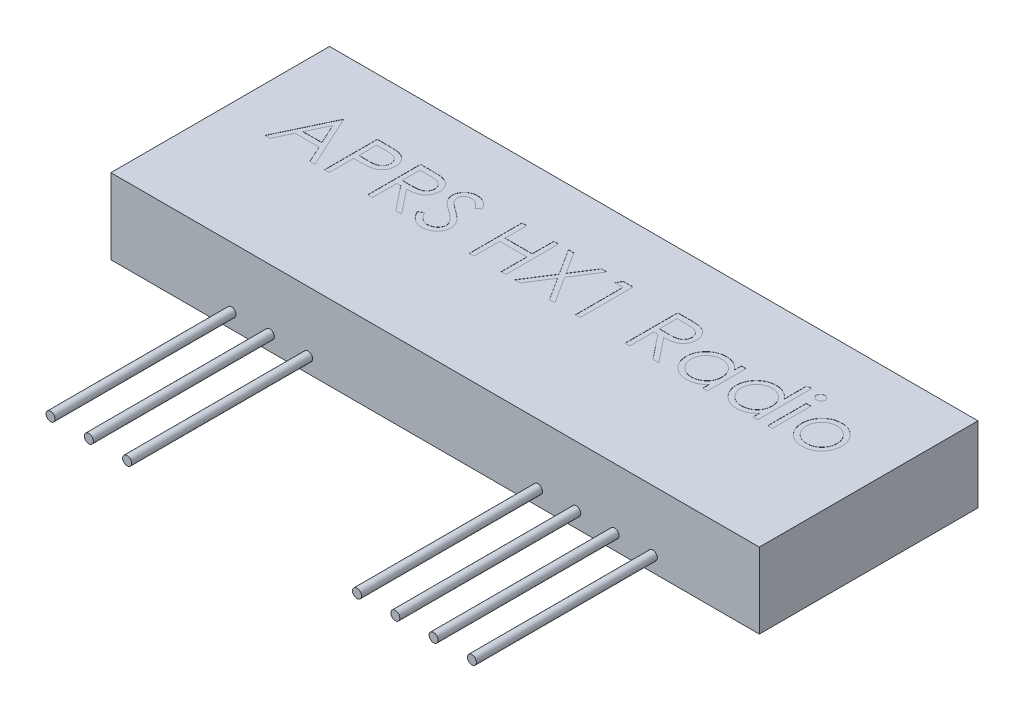
from build123d import *

# Parameters (mm, degrees)
SKETCH2_W           = 43
SKETCH2_H           = 14.5
BOSS_EXTRUDE1_DEPTH = 5
SKETCH3_R           = 0.3
BOSS_EXTRUDE2_DEPTH = 12
SKETCH4_W           = 0.314102564
SKETCH4_H           = 2.557692308
CUT_EXTRUDE1_DEPTH  = 0.01


with BuildPart() as part:
    # Sketch2 → Boss-Extrude1 (new body)
    with BuildSketch(Plane(origin=(0, 0, 0), x_dir=(1, 0, 0), z_dir=(0, 1, 0))):
        Rectangle(SKETCH2_W, SKETCH2_H)
    extrude(amount=BOSS_EXTRUDE1_DEPTH)

    # Sketch3 → Boss-Extrude2 (add)
    with BuildSketch(Plane.XY.offset(7.25)):
        with Locations(Location((6.82, 1, 0), (0, 0, 180))):
            Circle(SKETCH3_R)
        with Locations(Location((9.36, 1, 0), (0, 0, 180))):
            Circle(SKETCH3_R)
        with Locations(Location((11.9, 1, 0), (0, 0, 180))):
            Circle(SKETCH3_R)
        with Locations(Location((14.44, 1, 0), (0, 0, 180))):
            Circle(SKETCH3_R)
        with Locations(Location((-8.42, 1, 0), (0, 0, 180))):
            Circle(SKETCH3_R)
        with Locations(Location((-10.96, 1, 0), (0, 0, 180))):
            Circle(SKETCH3_R)
        with Locations(Location((-13.5, 1, 0), (0, 0, 180))):
            Circle(SKETCH3_R)
    extrude(amount=BOSS_EXTRUDE2_DEPTH)

    # Sketch4 → Cut-Extrude1 (cut)
    # profile 1 of 13: a face of its own
    with BuildSketch(Plane(origin=(0, 5, 0), x_dir=(1, 0, 0), z_dir=(0, 1, 0))):
        Polygon((-16.826923077, 3.5), (-15.211538462, 0), (-15.552984776, 0), (-16.07041266, 1.121794872), (-17.657051282, 1.121794872), (-18.189202724, 0), (-18.532051282, 0), (-16.871794872, 3.5), align=None)
        Polygon((-16.852864583, 2.817808494), (-17.486678686, 1.480769231), (-16.235877404, 1.480769231), align=None, mode=Mode.SUBTRACT)
    # profile 2 of 13: a face of its own
    with BuildSketch(Plane(origin=(0, 5, 0), x_dir=(1, 0, 0), z_dir=(0, 1, 0))):
        with BuildLine():
            Line((-14.583333333, 3.5), (-13.896935096, 3.5))
            add(Edge.make_bspline(
                [(-13.896935096, 3.5), (-13.84972419, 3.499948104), (-13.759265997, 3.499848668), (-13.629550941, 3.496833922), (-13.51174121, 3.49280723), (-13.406090829, 3.487225337), (-13.312274731, 3.480628747), (-13.230717431, 3.471376708), (-13.160777875, 3.461716412), (-13.118871426, 3.451895005), (-13.099759615, 3.447415865)],
                knots=[0, 0, 0, 0, 1.415646017, 2.712440637, 3.8905458, 4.950247383, 5.884950622, 6.709939814, 7.411656543, 8, 8, 8, 8], degree=3))
            add(Edge.make_bspline(
                [(-13.099759615, 3.447415865), (-13.075566082, 3.440793916), (-13.027749104, 3.427706054), (-12.958848061, 3.40149233), (-12.893294216, 3.370410165), (-12.830862657, 3.334986225), (-12.772320574, 3.293700661), (-12.716794533, 3.248227043), (-12.664774553, 3.197515475), (-12.616553161, 3.142134735), (-12.572268364, 3.083014525), (-12.534138681, 3.019272295), (-12.502211454, 2.951980992), (-12.474828182, 2.881187421), (-12.455119728, 2.806297097), (-12.440272828, 2.727830385), (-12.430849201, 2.645795695), (-12.429946639, 2.589735827), (-12.429487179, 2.561197917)],
                knots=[0, 0, 0, 0, 0.999701418, 1.975846123, 2.934577507, 3.890451536, 4.834027766, 5.787354733, 6.749476667, 7.726910423, 8.712836071, 9.690891519, 10.682875813, 11.679750201, 12.712814741, 13.765529915, 14.8625177, 16, 16, 16, 16], degree=3))
            add(Edge.make_bspline(
                [(-12.429487179, 2.561197917), (-12.429908604, 2.53242014), (-12.43073315, 2.476114476), (-12.440629435, 2.393741688), (-12.453959627, 2.315023298), (-12.474456679, 2.240133847), (-12.501302353, 2.169518077), (-12.532794405, 2.102096845), (-12.570777936, 2.039017173), (-12.614422765, 1.980050055), (-12.66297436, 1.925140143), (-12.716227298, 1.874685348), (-12.773966591, 1.82898101), (-12.836008739, 1.787924666), (-12.902958587, 1.752468387), (-12.973800741, 1.720711082), (-13.049150957, 1.694040021), (-13.101293471, 1.68000996), (-13.127804487, 1.672876603)],
                knots=[0, 0, 0, 0, 1.121902311, 2.195077645, 3.232258892, 4.234102512, 5.217864754, 6.176164875, 7.132989551, 8.084763148, 9.034132444, 9.988522005, 10.94243251, 11.903244335, 12.886203696, 13.894208494, 14.929344452, 16, 16, 16, 16], degree=3))
            add(Edge.make_bspline(
                [(-13.127804487, 1.672876603), (-13.149731821, 1.668213621), (-13.197786849, 1.657994427), (-13.276929571, 1.64658597), (-13.369074957, 1.63684837), (-13.474097237, 1.629547232), (-13.591902141, 1.623296864), (-13.722553399, 1.61832877), (-13.866307476, 1.615598916), (-13.96657872, 1.615458123), (-14.018930288, 1.615384615)],
                knots=[0, 0, 0, 0, 0.601384939, 1.31797006, 2.144135048, 3.087295005, 4.142315834, 5.309527816, 6.595305764, 8, 8, 8, 8], degree=3))
            Line((-14.018930288, 1.615384615), (-14.269230769, 1.615384615))
            Line((-14.269230769, 1.615384615), (-14.269230769, 0))
            Line((-14.269230769, 0), (-14.583333333, 0))
            Line((-14.583333333, 0), (-14.583333333, 3.5))
        make_face()
        with BuildLine():
            Line((-14.269230769, 3.141025641), (-14.269230769, 1.974358974))
            Line((-14.269230769, 1.974358974), (-13.656450321, 1.966646635))
            add(Edge.make_bspline(
                [(-13.656450321, 1.966646635), (-13.626530395, 1.966631171), (-13.568770595, 1.966601319), (-13.485334372, 1.970586542), (-13.407925084, 1.975187075), (-13.336780509, 1.981922998), (-13.271868574, 1.991444256), (-13.213081045, 2.001055994), (-13.160873763, 2.014961356), (-13.099774561, 2.033684426), (-13.031691213, 2.065617041), (-12.957623665, 2.111966931), (-12.894853078, 2.17104764), (-12.840534782, 2.237475471), (-12.797428904, 2.3113746), (-12.765872911, 2.390443537), (-12.747331754, 2.473871387), (-12.74484556, 2.530959525), (-12.743589744, 2.559795673)],
                knots=[0, 0, 0, 0, 1.160613943, 2.240541288, 3.23993089, 4.169200891, 5.011653406, 5.7853311, 6.478053781, 7.106038997, 8.262395093, 9.384106736, 10.481365981, 11.59014053, 12.70357646, 13.786202915, 14.881775077, 16, 16, 16, 16], degree=3))
            add(Edge.make_bspline(
                [(-12.743589744, 2.559795673), (-12.74485239, 2.587934187), (-12.747362375, 2.643870069), (-12.766018238, 2.725848829), (-12.797367552, 2.804084534), (-12.840824147, 2.877057619), (-12.893565277, 2.943246423), (-12.95486462, 3.00074355), (-13.024577881, 3.046965253), (-13.089426112, 3.076798534), (-13.147027298, 3.09501381), (-13.197059258, 3.10775865), (-13.253549932, 3.117934257), (-13.316517712, 3.126173759), (-13.385474546, 3.133227221), (-13.461012861, 3.138013198), (-13.542846504, 3.140814654), (-13.599657075, 3.140953609), (-13.629106571, 3.141025641)],
                knots=[0, 0, 0, 0, 1.120700087, 2.227813068, 3.331159281, 4.466773991, 5.599788987, 6.693661531, 7.80175334, 8.91857717, 9.525282508, 10.207424825, 10.974604443, 11.810962634, 12.737642355, 13.736264703, 14.826523623, 16, 16, 16, 16], degree=3))
            Line((-13.629106571, 3.141025641), (-14.269230769, 3.141025641))
        make_face(mode=Mode.SUBTRACT)
    # profile 3 of 13: a face of its own
    with BuildSketch(Plane(origin=(0, 5, 0), x_dir=(1, 0, 0), z_dir=(0, 1, 0))):
        with BuildLine():
            Line((-11.711538462, 3.5), (-11.011117788, 3.5))
            add(Edge.make_bspline(
                [(-11.011117788, 3.5), (-10.96437666, 3.499844414), (-10.874628516, 3.499545672), (-10.746055245, 3.497879909), (-10.629228148, 3.493105553), (-10.524208309, 3.48899697), (-10.430997654, 3.481505028), (-10.349310363, 3.474344381), (-10.279522666, 3.46497072), (-10.237276814, 3.456265297), (-10.218149038, 3.452323718)],
                knots=[0, 0, 0, 0, 1.410062039, 2.707475311, 3.878576406, 4.937260626, 5.877586885, 6.699081471, 7.410979367, 8, 8, 8, 8], degree=3))
            add(Edge.make_bspline(
                [(-10.218149038, 3.452323718), (-10.192542414, 3.445996953), (-10.141875425, 3.433478389), (-10.068925359, 3.407018788), (-9.999411035, 3.376399163), (-9.933621211, 3.340435443), (-9.871885419, 3.298860663), (-9.813567109, 3.252392541), (-9.758401645, 3.201285335), (-9.708620015, 3.144250494), (-9.661680963, 3.084413984), (-9.622092337, 3.019710227), (-9.587965857, 2.9520487), (-9.56079534, 2.880741282), (-9.538917367, 2.80647951), (-9.523491127, 2.728590713), (-9.51423994, 2.647429738), (-9.513298084, 2.59207183), (-9.512820513, 2.564002404)],
                knots=[0, 0, 0, 0, 1.027469482, 2.033020251, 3.019912614, 3.986113645, 4.951240523, 5.91722682, 6.890402269, 7.87763091, 8.8651537, 9.85103654, 10.82876324, 11.815024772, 12.821070561, 13.842952187, 14.906261191, 16, 16, 16, 16], degree=3))
            add(Edge.make_bspline(
                [(-9.512820513, 2.564002404), (-9.514289511, 2.517367299), (-9.517155907, 2.426370131), (-9.54388101, 2.29430925), (-9.58765753, 2.171119935), (-9.647980819, 2.056957297), (-9.724800295, 1.954046652), (-9.817125086, 1.863656197), (-9.925006697, 1.788016284), (-10.025436013, 1.735563479), (-10.114150213, 1.701970571), (-10.187183526, 1.678334212), (-10.266850503, 1.660072247), (-10.352387838, 1.643712115), (-10.444151493, 1.63136042), (-10.541921533, 1.622313826), (-10.645767684, 1.616659777), (-10.717106754, 1.615817772), (-10.75380609, 1.615384615)],
                knots=[0, 0, 0, 0, 1.260483769, 2.459530307, 3.627416485, 4.787058657, 5.939039949, 7.08810263, 8.267026773, 9.491475466, 10.141966685, 10.831826277, 11.566392101, 12.351337768, 13.187381173, 14.07005841, 15.007169909, 16, 16, 16, 16], degree=3))
            Line((-10.75380609, 1.615384615), (-9.467948718, 0))
            Line((-9.467948718, 0), (-9.856370192, 0))
            Line((-9.856370192, 0), (-11.142227564, 1.615384615))
            Line((-11.142227564, 1.615384615), (-11.397435897, 1.615384615))
            Line((-11.397435897, 1.615384615), (-11.397435897, 0))
            Line((-11.397435897, 0), (-11.711538462, 0))
            Line((-11.711538462, 0), (-11.711538462, 3.5))
        make_face()
        with BuildLine():
            Line((-11.397435897, 3.141025641), (-11.397435897, 1.974358974))
            Line((-11.397435897, 1.974358974), (-10.756610577, 1.969451122))
            add(Edge.make_bspline(
                [(-10.756610577, 1.969451122), (-10.726690538, 1.969437885), (-10.668696981, 1.969412229), (-10.584796316, 1.973406005), (-10.506676204, 1.977949323), (-10.434635452, 1.984898669), (-10.368641877, 1.99385474), (-10.308728464, 2.005057725), (-10.254797412, 2.018109787), (-10.191898873, 2.038311413), (-10.121662342, 2.070317431), (-10.045330882, 2.11688293), (-9.980328544, 2.175452049), (-9.925410682, 2.242425505), (-9.881281251, 2.316061754), (-9.850169196, 2.395478123), (-9.830426754, 2.478669721), (-9.828098209, 2.535847829), (-9.826923077, 2.564703526)],
                knots=[0, 0, 0, 0, 1.146690395, 2.22261258, 3.21895312, 4.145990853, 4.996080663, 5.770904154, 6.481378293, 7.121626537, 8.300444488, 9.431385265, 10.535395872, 11.636531494, 12.74115979, 13.810798291, 14.895190096, 16, 16, 16, 16], degree=3))
            add(Edge.make_bspline(
                [(-9.826923077, 2.564703526), (-9.828125198, 2.592850099), (-9.830507363, 2.648626338), (-9.849956132, 2.730282248), (-9.882845513, 2.807349198), (-9.927167751, 2.879513683), (-9.981166906, 2.945019419), (-10.044484719, 3.001066572), (-10.115389914, 3.047316037), (-10.181661112, 3.076870418), (-10.240895325, 3.094990271), (-10.292324985, 3.107741435), (-10.350436463, 3.117985904), (-10.415511921, 3.126193964), (-10.487273552, 3.133248909), (-10.566084203, 3.138000687), (-10.651420983, 3.140814551), (-10.710567915, 3.14095364), (-10.741185897, 3.141025641)],
                knots=[0, 0, 0, 0, 1.101028733, 2.181837193, 3.264309656, 4.369019818, 5.486613113, 6.575447106, 7.666700264, 8.788928104, 9.402425223, 10.0903467, 10.862060571, 11.710948788, 12.657782767, 13.684531032, 14.801375019, 16, 16, 16, 16], degree=3))
            Line((-10.741185897, 3.141025641), (-11.397435897, 3.141025641))
        make_face(mode=Mode.SUBTRACT)
    # profile 4 of 13: a face of its own
    with BuildSketch(Plane(origin=(0, 5, 0), x_dir=(1, 0, 0), z_dir=(0, 1, 0))):
        with BuildLine():
            Line((-9.108974359, 0.675180288), (-8.813100962, 0.852564103))
            add(Edge.make_bspline(
                [(-8.813100962, 0.852564103), (-8.785582724, 0.806499718), (-8.732858844, 0.718242134), (-8.644907485, 0.598984093), (-8.553774573, 0.497621937), (-8.45878524, 0.414745329), (-8.360519292, 0.349496442), (-8.258335238, 0.303294211), (-8.152577427, 0.274478235), (-8.080603606, 0.270978149), (-8.044671474, 0.269230769)],
                knots=[0, 0, 0, 0, 1.272034388, 2.437168799, 3.508375237, 4.49857839, 5.41946034, 6.295179144, 7.148887113, 8, 8, 8, 8], degree=3))
            add(Edge.make_bspline(
                [(-8.044671474, 0.269230769), (-8.013984614, 0.270085442), (-7.953147841, 0.271779832), (-7.863585598, 0.288060634), (-7.776603796, 0.313072763), (-7.693995158, 0.348893694), (-7.616899543, 0.39223218), (-7.549292848, 0.444578358), (-7.490846735, 0.503184563), (-7.44303762, 0.568567218), (-7.406357585, 0.638884367), (-7.378165517, 0.711060318), (-7.362520443, 0.786228886), (-7.360163689, 0.836839349), (-7.358974359, 0.862379808)],
                knots=[0, 0, 0, 0, 1.095163259, 2.171163733, 3.241058638, 4.321873601, 5.38011039, 6.391990106, 7.366004449, 8.327778327, 9.272591725, 10.192022065, 11.087607919, 12, 12, 12, 12], degree=3))
            add(Edge.make_bspline(
                [(-7.358974359, 0.862379808), (-7.36044867, 0.891520657), (-7.363445728, 0.950759747), (-7.388777208, 1.0381594), (-7.428626455, 1.12465197), (-7.465389099, 1.178153235), (-7.48447516, 1.205929487)],
                knots=[0, 0, 0, 0, 0.938893495, 1.908633276, 2.914225137, 4, 4, 4, 4], degree=3))
            add(Edge.make_bspline(
                [(-7.48447516, 1.205929487), (-7.500145774, 1.225976311), (-7.533044269, 1.268062109), (-7.589601781, 1.330707345), (-7.655967896, 1.395325764), (-7.729871451, 1.464384821), (-7.814004539, 1.534672617), (-7.905732054, 1.609540895), (-8.007395913, 1.686142472), (-8.078695409, 1.737515038), (-8.115484776, 1.764022436)],
                knots=[0, 0, 0, 0, 0.722233717, 1.516239348, 2.393582979, 3.351407094, 4.387010283, 5.505090956, 6.712668013, 8, 8, 8, 8], degree=3))
            add(Edge.make_bspline(
                [(-8.115484776, 1.764022436), (-8.152308772, 1.790251024), (-8.222713448, 1.840398086), (-8.321172031, 1.91482237), (-8.409216494, 1.982866239), (-8.48645551, 2.045170251), (-8.552855107, 2.101742856), (-8.608938518, 2.152040795), (-8.653277075, 2.197424356), (-8.677932656, 2.226865698), (-8.689002404, 2.240084135)],
                knots=[0, 0, 0, 0, 1.452282411, 2.77665338, 3.964542531, 5.026858415, 5.96415736, 6.766646006, 7.446254459, 8, 8, 8, 8], degree=3))
            add(Edge.make_bspline(
                [(-8.689002404, 2.240084135), (-8.704474949, 2.260685171), (-8.734903786, 2.301199875), (-8.775069791, 2.364524733), (-8.809208954, 2.429347998), (-8.835971286, 2.495843863), (-8.858507505, 2.563078792), (-8.873665436, 2.631930038), (-8.883156833, 2.702088656), (-8.884128819, 2.749302157), (-8.884615385, 2.772936699)],
                knots=[0, 0, 0, 0, 1.068054152, 2.10047183, 3.106115577, 4.101338837, 5.06977816, 6.043150881, 7.020423561, 8, 8, 8, 8], degree=3))
            add(Edge.make_bspline(
                [(-8.884615385, 2.772936699), (-8.883310176, 2.809966473), (-8.880727656, 2.883234537), (-8.858887138, 2.990265367), (-8.824414245, 3.092451785), (-8.776119357, 3.188782118), (-8.713862004, 3.276748099), (-8.641816029, 3.357361586), (-8.556004543, 3.425130168), (-8.46185192, 3.484342227), (-8.358795548, 3.530688152), (-8.250804645, 3.565649132), (-8.137707572, 3.58545839), (-8.061104438, 3.588301155), (-8.022235577, 3.58974359)],
                knots=[0, 0, 0, 0, 1.005424448, 1.989358655, 2.955360095, 3.929531133, 4.905563448, 5.876582895, 6.856512386, 7.866279853, 8.892233794, 9.918561126, 10.94386622, 12, 12, 12, 12], degree=3))
            add(Edge.make_bspline(
                [(-8.022235577, 3.58974359), (-7.980991477, 3.588321038), (-7.898970125, 3.585492037), (-7.778320909, 3.560894506), (-7.662160193, 3.520193834), (-7.568716928, 3.474005176), (-7.495584167, 3.42787376), (-7.439811434, 3.385853936), (-7.383293983, 3.337478827), (-7.325575928, 3.282619581), (-7.267635269, 3.22077283), (-7.208611817, 3.152362141), (-7.148367548, 3.077805585), (-7.109611688, 3.024581085), (-7.08974359, 2.997295673)],
                knots=[0, 0, 0, 0, 1.286793592, 2.559021753, 3.825965368, 5.121522368, 5.803751409, 6.523245864, 7.299691795, 8.125521123, 9.008227632, 9.944561021, 10.946284179, 12, 12, 12, 12], degree=3))
            Line((-7.08974359, 2.997295673), (-7.373697917, 2.782051282))
            add(Edge.make_bspline(
                [(-7.373697917, 2.782051282), (-7.390843849, 2.804139972), (-7.423862906, 2.846677626), (-7.473992393, 2.906248941), (-7.521241041, 2.960665421), (-7.567791441, 3.007930549), (-7.611185072, 3.050632682), (-7.653302114, 3.087192439), (-7.693536466, 3.117968034), (-7.744253376, 3.150811594), (-7.807971095, 3.183368098), (-7.887955631, 3.210917176), (-7.971541906, 3.227472238), (-8.028471537, 3.229661126), (-8.057291667, 3.230769231)],
                knots=[0, 0, 0, 0, 1.181633172, 2.275549214, 3.290209073, 4.226197932, 5.078386478, 5.862611352, 6.581680152, 7.217281963, 8.414376989, 9.595101626, 10.782541182, 12, 12, 12, 12], degree=3))
            add(Edge.make_bspline(
                [(-8.057291667, 3.230769231), (-8.093448189, 3.229557531), (-8.163172636, 3.227220882), (-8.262162873, 3.201700896), (-8.351256798, 3.161519036), (-8.427809363, 3.105204058), (-8.49154634, 3.038483065), (-8.537651799, 2.96170421), (-8.565401963, 2.876921808), (-8.568788243, 2.817780151), (-8.570512821, 2.787660256)],
                knots=[0, 0, 0, 0, 1.14458467, 2.207223713, 3.21896685, 4.227309161, 5.202851033, 6.127160689, 7.046193047, 8, 8, 8, 8], degree=3))
            add(Edge.make_bspline(
                [(-8.570512821, 2.787660256), (-8.570119694, 2.768908778), (-8.569332798, 2.731375158), (-8.558358, 2.675923736), (-8.544258671, 2.620612397), (-8.521916039, 2.565689814), (-8.491070736, 2.510195455), (-8.45056556, 2.453173718), (-8.399552248, 2.394122009), (-8.360475235, 2.355714635), (-8.33984375, 2.335436699)],
                knots=[0, 0, 0, 0, 0.858281714, 1.717966888, 2.583508476, 3.4729293, 4.427298488, 5.488583878, 6.674047936, 8, 8, 8, 8], degree=3))
            add(Edge.make_bspline(
                [(-8.33984375, 2.335436699), (-8.332182378, 2.328599673), (-8.31398071, 2.312356465), (-8.280704785, 2.285764184), (-8.236761986, 2.252961412), (-8.183299785, 2.212374095), (-8.119332424, 2.165292633), (-8.044852867, 2.112319021), (-7.960691335, 2.051733562), (-7.900969419, 2.009376021), (-7.869391026, 1.986979167)],
                knots=[0, 0, 0, 0, 0.420754252, 0.999615792, 1.744751191, 2.668019286, 3.750313428, 4.999500688, 6.413464383, 8, 8, 8, 8], degree=3))
            add(Edge.make_bspline(
                [(-7.869391026, 1.986979167), (-7.831405112, 1.959337807), (-7.757850656, 1.905814145), (-7.653193076, 1.825398465), (-7.558299268, 1.746750697), (-7.472836064, 1.67037309), (-7.395959156, 1.596844997), (-7.328521435, 1.525281816), (-7.269835755, 1.456196244), (-7.206656536, 1.367623668), (-7.142098717, 1.258842584), (-7.08665721, 1.125564345), (-7.051698862, 0.991768025), (-7.047127347, 0.901841188), (-7.044871795, 0.857471955)],
                knots=[0, 0, 0, 0, 1.163667725, 2.253281268, 3.268753668, 4.215851969, 5.092017293, 5.902905408, 6.650798638, 7.335211899, 8.59617414, 9.77448103, 10.901945474, 12, 12, 12, 12], degree=3))
            add(Edge.make_bspline(
                [(-7.044871795, 0.857471955), (-7.045528933, 0.82609359), (-7.046830448, 0.763946206), (-7.061791362, 0.67269113), (-7.083711027, 0.58406026), (-7.116748261, 0.499149147), (-7.157071419, 0.416404385), (-7.208237667, 0.337996484), (-7.267545352, 0.262190086), (-7.335579117, 0.191006594), (-7.410025019, 0.125660398), (-7.488708714, 0.067531337), (-7.571758987, 0.019063014), (-7.658725303, -0.020487828), (-7.74962764, -0.051421346), (-7.844435424, -0.073834215), (-7.943304935, -0.087589926), (-8.010505417, -0.089017687), (-8.044671474, -0.08974359)],
                knots=[0, 0, 0, 0, 0.983748083, 1.948392443, 2.894712957, 3.844097841, 4.80183111, 5.778335162, 6.776009319, 7.81870978, 8.863265674, 9.881300176, 10.883814829, 11.87499822, 12.874611388, 13.892143829, 14.928324115, 16, 16, 16, 16], degree=3))
            add(Edge.make_bspline(
                [(-8.044671474, -0.08974359), (-8.071106817, -0.089232408), (-8.123644577, -0.088216483), (-8.201354059, -0.079235202), (-8.277493648, -0.066528099), (-8.35110793, -0.046354029), (-8.423145342, -0.021877052), (-8.493292577, 0.008261281), (-8.561583631, 0.044378482), (-8.628401213, 0.085673507), (-8.693575388, 0.133731252), (-8.756494856, 0.189704748), (-8.819224041, 0.252050253), (-8.879911438, 0.322460816), (-8.939784582, 0.399798899), (-8.997662992, 0.484788083), (-9.054744709, 0.576965436), (-9.090560177, 0.641830522), (-9.108974359, 0.675180288)],
                knots=[0, 0, 0, 0, 0.915332311, 1.819136955, 2.706846663, 3.586547465, 4.459518054, 5.340707479, 6.227863349, 7.133153174, 8.059268498, 9.028702269, 10.047606654, 11.120612155, 12.245963614, 13.433783089, 14.680604001, 16, 16, 16, 16], degree=3))
        make_face()
    # profile 5 of 13: a face of its own
    with BuildSketch(Plane(origin=(0, 5, 0), x_dir=(1, 0, 0), z_dir=(0, 1, 0))):
        Polygon((-4.980769231, 3.5), (-4.666666667, 3.5), (-4.666666667, 2.064102564), (-2.871794872, 2.064102564), (-2.871794872, 3.5), (-2.557692308, 3.5), (-2.557692308, 0), (-2.871794872, 0), (-2.871794872, 1.705128205), (-4.666666667, 1.705128205), (-4.666666667, 0), (-4.980769231, 0), align=None)
    # profile 6 of 13: a face of its own
    with BuildSketch(Plane(origin=(0, 5, 0), x_dir=(1, 0, 0), z_dir=(0, 1, 0))):
        Polygon((-1.907051282, 3.5), (-1.544571314, 3.5), (-0.628205128, 2.068309295), (0.288161058, 3.5), (0.650641026, 3.5), (-0.446614583, 1.78505609), (0.695512821, 0), (0.333032853, 0), (-0.628205128, 1.501802885), (-1.589443109, 0), (-1.951923077, 0), (-0.809094551, 1.78505609), align=None)
    # profile 7 of 13: a face of its own
    with BuildSketch(Plane(origin=(0, 5, 0), x_dir=(1, 0, 0), z_dir=(0, 1, 0))):
        Polygon((1.731069712, 3.5), (2.378205128, 3.5), (2.378205128, 0), (2.064102564, 0), (2.064102564, 3.141025641), (1.525641026, 3.141025641), align=None)
    # profile 8 of 13: a face of its own
    with BuildSketch(Plane(origin=(0, 5, 0), x_dir=(1, 0, 0), z_dir=(0, 1, 0))):
        with BuildLine():
            Line((5.33974359, 3.5), (6.040164263, 3.5))
            add(Edge.make_bspline(
                [(6.040164263, 3.5), (6.086905391, 3.499844414), (6.176653536, 3.499545672), (6.305226806, 3.497879909), (6.422053903, 3.493105553), (6.527073742, 3.48899697), (6.620284397, 3.481505028), (6.701971688, 3.474344381), (6.771759386, 3.46497072), (6.814005237, 3.456265297), (6.833133013, 3.452323718)],
                knots=[0, 0, 0, 0, 1.410062039, 2.707475311, 3.878576406, 4.937260626, 5.877586885, 6.699081471, 7.410979367, 8, 8, 8, 8], degree=3))
            add(Edge.make_bspline(
                [(6.833133013, 3.452323718), (6.858739637, 3.445996953), (6.909406626, 3.433478389), (6.982356692, 3.407018788), (7.051871016, 3.376399163), (7.117660841, 3.340435443), (7.179396632, 3.298860663), (7.237714943, 3.252392541), (7.292880406, 3.201285335), (7.342662036, 3.144250494), (7.389601088, 3.084413984), (7.429189714, 3.019710227), (7.463316194, 2.9520487), (7.490486711, 2.880741282), (7.512364685, 2.80647951), (7.527790924, 2.728590713), (7.537042112, 2.647429738), (7.537983967, 2.59207183), (7.538461538, 2.564002404)],
                knots=[0, 0, 0, 0, 1.027469482, 2.033020251, 3.019912614, 3.986113645, 4.951240523, 5.91722682, 6.890402269, 7.87763091, 8.8651537, 9.85103654, 10.82876324, 11.815024772, 12.821070561, 13.842952187, 14.906261191, 16, 16, 16, 16], degree=3))
            add(Edge.make_bspline(
                [(7.538461538, 2.564002404), (7.53699254, 2.517367299), (7.534126145, 2.426370131), (7.507401041, 2.29430925), (7.463624521, 2.171119935), (7.403301232, 2.056957297), (7.326481756, 1.954046652), (7.234156965, 1.863656197), (7.126275354, 1.788016284), (7.025846038, 1.735563479), (6.937131838, 1.701970571), (6.864098525, 1.678334212), (6.784431548, 1.660072247), (6.698894213, 1.643712115), (6.607130558, 1.63136042), (6.509360518, 1.622313826), (6.405514367, 1.616659777), (6.334175297, 1.615817772), (6.297475962, 1.615384615)],
                knots=[0, 0, 0, 0, 1.260483769, 2.459530307, 3.627416485, 4.787058657, 5.939039949, 7.08810263, 8.267026773, 9.491475466, 10.141966685, 10.831826277, 11.566392101, 12.351337768, 13.187381173, 14.07005841, 15.007169909, 16, 16, 16, 16], degree=3))
            Line((6.297475962, 1.615384615), (7.583333333, 0))
            Line((7.583333333, 0), (7.194911859, 0))
            Line((7.194911859, 0), (5.909054487, 1.615384615))
            Line((5.909054487, 1.615384615), (5.653846154, 1.615384615))
            Line((5.653846154, 1.615384615), (5.653846154, 0))
            Line((5.653846154, 0), (5.33974359, 0))
            Line((5.33974359, 0), (5.33974359, 3.5))
        make_face()
        with BuildLine():
            Line((5.653846154, 3.141025641), (5.653846154, 1.974358974))
            Line((5.653846154, 1.974358974), (6.294671474, 1.969451122))
            add(Edge.make_bspline(
                [(6.294671474, 1.969451122), (6.324591513, 1.969437885), (6.38258507, 1.969412229), (6.466485735, 1.973406005), (6.544605847, 1.977949323), (6.616646599, 1.984898669), (6.682640174, 1.99385474), (6.742553588, 2.005057725), (6.79648464, 2.018109787), (6.859383178, 2.038311413), (6.929619709, 2.070317431), (7.005951169, 2.11688293), (7.070953507, 2.175452049), (7.125871369, 2.242425505), (7.170000801, 2.316061754), (7.201112855, 2.395478123), (7.220855297, 2.478669721), (7.223183843, 2.535847829), (7.224358974, 2.564703526)],
                knots=[0, 0, 0, 0, 1.146690395, 2.22261258, 3.21895312, 4.145990853, 4.996080663, 5.770904154, 6.481378293, 7.121626537, 8.300444488, 9.431385265, 10.535395872, 11.636531494, 12.74115979, 13.810798291, 14.895190096, 16, 16, 16, 16], degree=3))
            add(Edge.make_bspline(
                [(7.224358974, 2.564703526), (7.223156853, 2.592850099), (7.220774688, 2.648626338), (7.201325919, 2.730282248), (7.168436538, 2.807349198), (7.1241143, 2.879513683), (7.070115145, 2.945019419), (7.006797332, 3.001066572), (6.935892137, 3.047316037), (6.869620939, 3.076870418), (6.810386726, 3.094990271), (6.758957066, 3.107741435), (6.700845589, 3.117985904), (6.63577013, 3.126193964), (6.564008499, 3.133248909), (6.485197848, 3.138000687), (6.399861068, 3.140814551), (6.340714137, 3.14095364), (6.310096154, 3.141025641)],
                knots=[0, 0, 0, 0, 1.101028733, 2.181837193, 3.264309656, 4.369019818, 5.486613113, 6.575447106, 7.666700264, 8.788928104, 9.402425223, 10.0903467, 10.862060571, 11.710948788, 12.657782767, 13.684531032, 14.801375019, 16, 16, 16, 16], degree=3))
            Line((6.310096154, 3.141025641), (5.653846154, 3.141025641))
        make_face(mode=Mode.SUBTRACT)
    # profile 9 of 13: a face of its own
    with BuildSketch(Plane(origin=(0, 5, 0), x_dir=(1, 0, 0), z_dir=(0, 1, 0))):
        with BuildLine():
            Line((10.814102564, 2.557692308), (10.814102564, 0))
            Line((10.814102564, 0), (10.5, 0))
            Line((10.5, 0), (10.5, 0.442407853))
            add(Edge.make_bspline(
                [(10.5, 0.442407853), (10.464581209, 0.402368259), (10.395460994, 0.324230488), (10.280019876, 0.222148315), (10.157651698, 0.137769993), (10.028950377, 0.069620078), (9.894032134, 0.018428021), (9.753196046, -0.017958138), (9.606384666, -0.041351973), (9.506132311, -0.043687995), (9.455328526, -0.044871795)],
                knots=[0, 0, 0, 0, 1.074387032, 2.096679803, 3.090159297, 4.057316773, 5.018401886, 5.985159533, 6.978961417, 8, 8, 8, 8], degree=3))
            add(Edge.make_bspline(
                [(9.455328526, -0.044871795), (9.410160572, -0.043645423), (9.321087367, -0.041226962), (9.19005829, -0.022464659), (9.06396604, 0.007665963), (8.942691468, 0.049566853), (8.827019322, 0.105147674), (8.715959226, 0.171688922), (8.610086534, 0.250929752), (8.511014995, 0.341517781), (8.419782994, 0.439912768), (8.339721722, 0.544858315), (8.272968642, 0.655900619), (8.217148561, 0.771633773), (8.174152217, 0.892948692), (8.144178582, 1.01942586), (8.125438136, 1.150915734), (8.123020675, 1.240455257), (8.121794872, 1.285857372)],
                knots=[0, 0, 0, 0, 1.033919861, 2.038935746, 3.024066025, 3.998881131, 4.97069526, 5.957263378, 6.95902576, 7.993208707, 9.027059324, 10.027763471, 11.009749337, 11.988697705, 12.965288445, 13.950418724, 14.960734635, 16, 16, 16, 16], degree=3))
            add(Edge.make_bspline(
                [(8.121794872, 1.285857372), (8.123047843, 1.330321075), (8.1255249, 1.418223419), (8.14397812, 1.547502117), (8.175009129, 1.672020377), (8.218556976, 1.791377321), (8.274398931, 1.905717371), (8.342327018, 2.015121396), (8.422346143, 2.119890793), (8.51459855, 2.21756202), (8.61453332, 2.307782634), (8.721442051, 2.38619168), (8.832665332, 2.453908529), (8.949928343, 2.507562005), (9.071495448, 2.550971109), (9.198448893, 2.581004078), (9.330260472, 2.598701399), (9.419750964, 2.601264163), (9.465144231, 2.602564103)],
                knots=[0, 0, 0, 0, 1.020392517, 2.01726096, 2.990465484, 3.961182959, 4.928053699, 5.906110375, 6.912531644, 7.948652711, 8.985773172, 9.998621852, 10.987621588, 11.969261332, 12.953316658, 13.946091881, 14.958173133, 16, 16, 16, 16], degree=3))
            add(Edge.make_bspline(
                [(9.465144231, 2.602564103), (9.51734409, 2.601126351), (9.61970555, 2.598306988), (9.769433559, 2.574844261), (9.911078037, 2.535205794), (10.045732389, 2.481288296), (10.172913075, 2.409639567), (10.291416059, 2.319259606), (10.402481543, 2.210718419), (10.466861834, 2.127347974), (10.5, 2.084435096)],
                knots=[0, 0, 0, 0, 1.038897134, 2.037228247, 3.008116434, 3.962042015, 4.918381754, 5.904844433, 6.921570401, 8, 8, 8, 8], degree=3))
            Line((10.5, 2.084435096), (10.5, 2.557692308))
            Line((10.5, 2.557692308), (10.814102564, 2.557692308))
        make_face()
        with BuildLine():
            add(Edge.make_bspline(
                [(9.469350962, 2.288461538), (9.423436624, 2.286827901), (9.332809024, 2.28360336), (9.199765022, 2.258429865), (9.072451608, 2.21654527), (8.951505533, 2.159263369), (8.838837317, 2.087234632), (8.738143646, 2.000113249), (8.648600944, 1.900276235), (8.57329268, 1.788174125), (8.511902183, 1.667996033), (8.468735151, 1.542371595), (8.440265904, 1.413566618), (8.437357383, 1.326203932), (8.435897436, 1.282351763)],
                knots=[0, 0, 0, 0, 1.031046209, 2.035121221, 3.029706178, 4.034933723, 5.034054252, 6.02443088, 7.017295772, 8.038157696, 9.050218397, 10.03989886, 11.016116709, 12, 12, 12, 12], degree=3))
            add(Edge.make_bspline(
                [(8.435897436, 1.282351763), (8.437762329, 1.238761656), (8.441484806, 1.1517523), (8.4682355, 1.022771723), (8.513115374, 0.897117681), (8.574357437, 0.775856687), (8.651044061, 0.663272587), (8.739932714, 0.561532464), (8.841882995, 0.474042876), (8.954810502, 0.400805303), (9.075418473, 0.341642782), (9.202252404, 0.300477142), (9.332928042, 0.273899362), (9.421780376, 0.270794885), (9.466546474, 0.269230769)],
                knots=[0, 0, 0, 0, 0.979072187, 1.954306742, 2.945804271, 3.96968567, 4.997920485, 5.998718438, 6.996577872, 8.005894225, 9.015743152, 10.005417472, 10.995077863, 12, 12, 12, 12], degree=3))
            add(Edge.make_bspline(
                [(9.466546474, 0.269230769), (9.511992977, 0.270890733), (9.602381564, 0.274192237), (9.735820272, 0.299473502), (9.865315234, 0.3412423), (9.989102463, 0.399141427), (10.104418594, 0.470898783), (10.207916471, 0.554905874), (10.29543244, 0.652609058), (10.369625049, 0.759985511), (10.427800466, 0.877697508), (10.470176525, 1.003031698), (10.495230431, 1.135992447), (10.498388161, 1.226856374), (10.5, 1.273237179)],
                knots=[0, 0, 0, 0, 1.01762866, 2.023962475, 3.030623092, 4.058876274, 5.077231937, 6.066672613, 7.034107872, 8.005628644, 8.981990164, 9.965428785, 10.961468474, 12, 12, 12, 12], degree=3))
            add(Edge.make_bspline(
                [(10.5, 1.273237179), (10.499040344, 1.30857501), (10.497151436, 1.378131043), (10.482720867, 1.480258561), (10.45976594, 1.577992287), (10.42741977, 1.671434976), (10.384928486, 1.760069991), (10.33368072, 1.844533752), (10.27277527, 1.924386963), (10.203192574, 1.998530034), (10.127027372, 2.066156496), (10.046432831, 2.126520737), (9.960454084, 2.17610951), (9.870537047, 2.217150781), (9.776525713, 2.249809931), (9.677655093, 2.271597625), (9.574976106, 2.286557946), (9.50493005, 2.287820327), (9.469350962, 2.288461538)],
                knots=[0, 0, 0, 0, 1.050140795, 2.067009409, 3.05949893, 4.030605086, 5.00011959, 5.97591094, 6.962425594, 7.979863591, 8.993523472, 9.986985069, 10.967611495, 11.937549037, 12.921786183, 13.919465291, 14.943216303, 16, 16, 16, 16], degree=3))
        make_face(mode=Mode.SUBTRACT)
    # profile 10 of 13: a face of its own
    with BuildSketch(Plane(origin=(0, 5, 0), x_dir=(1, 0, 0), z_dir=(0, 1, 0))):
        with BuildLine():
            Line((14.134615385, 3.58974359), (14.134615385, 0))
            Line((14.134615385, 0), (13.820512821, 0))
            Line((13.820512821, 0), (13.820512821, 0.442407853))
            add(Edge.make_bspline(
                [(13.820512821, 0.442407853), (13.78509403, 0.402368259), (13.715973815, 0.324230488), (13.600532697, 0.222148315), (13.478164519, 0.137769993), (13.349463198, 0.069620078), (13.214544954, 0.018428021), (13.073708867, -0.017958138), (12.926897486, -0.041351973), (12.826645131, -0.043687995), (12.775841346, -0.044871795)],
                knots=[0, 0, 0, 0, 1.074387032, 2.096679803, 3.090159297, 4.057316773, 5.018401886, 5.985159533, 6.978961417, 8, 8, 8, 8], degree=3))
            add(Edge.make_bspline(
                [(12.775841346, -0.044871795), (12.730673392, -0.043645423), (12.641600187, -0.041226962), (12.51057111, -0.022464659), (12.384478861, 0.007665963), (12.263204288, 0.049566853), (12.147532143, 0.105147674), (12.036472046, 0.171688922), (11.930599354, 0.250929752), (11.831527815, 0.341517781), (11.740295815, 0.439912768), (11.660234542, 0.544858315), (11.593481462, 0.655900619), (11.537661382, 0.771633773), (11.494665037, 0.892948692), (11.464691403, 1.01942586), (11.445950956, 1.150915734), (11.443533495, 1.240455257), (11.442307692, 1.285857372)],
                knots=[0, 0, 0, 0, 1.033919861, 2.038935746, 3.024066025, 3.998881131, 4.97069526, 5.957263378, 6.95902576, 7.993208707, 9.027059324, 10.027763471, 11.009749337, 11.988697705, 12.965288445, 13.950418724, 14.960734635, 16, 16, 16, 16], degree=3))
            add(Edge.make_bspline(
                [(11.442307692, 1.285857372), (11.443560664, 1.330321075), (11.446037721, 1.418223419), (11.46449094, 1.547502117), (11.495521949, 1.672020377), (11.539069797, 1.791377321), (11.594911752, 1.905717371), (11.662839839, 2.015121396), (11.742858963, 2.119890793), (11.83511137, 2.21756202), (11.935046141, 2.307782634), (12.041954871, 2.38619168), (12.153178153, 2.453908529), (12.270441163, 2.507562005), (12.392008268, 2.550971109), (12.518961714, 2.581004078), (12.650773293, 2.598701399), (12.740263785, 2.601264163), (12.785657051, 2.602564103)],
                knots=[0, 0, 0, 0, 1.020392517, 2.01726096, 2.990465484, 3.961182959, 4.928053699, 5.906110375, 6.912531644, 7.948652711, 8.985773172, 9.998621852, 10.987621588, 11.969261332, 12.953316658, 13.946091881, 14.958173133, 16, 16, 16, 16], degree=3))
            add(Edge.make_bspline(
                [(12.785657051, 2.602564103), (12.837873859, 2.600997007), (12.94036965, 2.597920971), (13.090268171, 2.572214604), (13.232055782, 2.529051726), (13.366548769, 2.469960445), (13.492945329, 2.393159694), (13.61217197, 2.300408246), (13.722155293, 2.1890811), (13.787227115, 2.105469526), (13.820512821, 2.062700321)],
                knots=[0, 0, 0, 0, 1.031072012, 2.023879775, 2.993683497, 3.952812103, 4.918022106, 5.908088563, 6.929940113, 8, 8, 8, 8], degree=3))
            Line((13.820512821, 2.062700321), (13.820512821, 3.58974359))
            Line((13.820512821, 3.58974359), (14.134615385, 3.58974359))
        make_face()
        with BuildLine():
            add(Edge.make_bspline(
                [(12.789863782, 2.288461538), (12.743949444, 2.286827901), (12.653321844, 2.28360336), (12.520277842, 2.258429865), (12.392964428, 2.21654527), (12.272018354, 2.159263369), (12.159350137, 2.087234632), (12.058656466, 2.000113249), (11.969113765, 1.900276235), (11.893805501, 1.788174125), (11.832415004, 1.667996033), (11.789247972, 1.542371595), (11.760778724, 1.413566618), (11.757870204, 1.326203932), (11.756410256, 1.282351763)],
                knots=[0, 0, 0, 0, 1.031046209, 2.035121221, 3.029706178, 4.034933723, 5.034054252, 6.02443088, 7.017295772, 8.038157696, 9.050218397, 10.03989886, 11.016116709, 12, 12, 12, 12], degree=3))
            add(Edge.make_bspline(
                [(11.756410256, 1.282351763), (11.75827515, 1.238761656), (11.761997627, 1.1517523), (11.788748321, 1.022771723), (11.833628194, 0.897117681), (11.894870257, 0.775856687), (11.971556882, 0.663272587), (12.060445534, 0.561532464), (12.162395816, 0.474042876), (12.275323323, 0.400805303), (12.395931293, 0.341642782), (12.522765225, 0.300477142), (12.653440863, 0.273899362), (12.742293197, 0.270794885), (12.787059295, 0.269230769)],
                knots=[0, 0, 0, 0, 0.979072187, 1.954306742, 2.945804271, 3.96968567, 4.997920485, 5.998718438, 6.996577872, 8.005894225, 9.015743152, 10.005417472, 10.995077863, 12, 12, 12, 12], degree=3))
            add(Edge.make_bspline(
                [(12.787059295, 0.269230769), (12.832505798, 0.270890733), (12.922894384, 0.274192237), (13.056333092, 0.299473502), (13.185828055, 0.3412423), (13.309615283, 0.399141427), (13.424931414, 0.470898783), (13.528429292, 0.554905874), (13.61594526, 0.652609058), (13.69013787, 0.759985511), (13.748313287, 0.877697508), (13.790689346, 1.003031698), (13.815743252, 1.135992447), (13.818900981, 1.226856374), (13.820512821, 1.273237179)],
                knots=[0, 0, 0, 0, 1.01762866, 2.023962475, 3.030623092, 4.058876274, 5.077231937, 6.066672613, 7.034107872, 8.005628644, 8.981990164, 9.965428785, 10.961468474, 12, 12, 12, 12], degree=3))
            add(Edge.make_bspline(
                [(13.820512821, 1.273237179), (13.819553164, 1.30857501), (13.817664257, 1.378131043), (13.803233687, 1.480258561), (13.780278761, 1.577992287), (13.747932591, 1.671434976), (13.705441306, 1.760069991), (13.65419354, 1.844533752), (13.593288091, 1.924386963), (13.523705395, 1.998530034), (13.447540192, 2.066156496), (13.366945651, 2.126520737), (13.280966904, 2.17610951), (13.191049868, 2.217150781), (13.097038533, 2.249809931), (12.998167913, 2.271597625), (12.895488926, 2.286557946), (12.825442871, 2.287820327), (12.789863782, 2.288461538)],
                knots=[0, 0, 0, 0, 1.050140795, 2.067009409, 3.05949893, 4.030605086, 5.00011959, 5.97591094, 6.962425594, 7.979863591, 8.993523472, 9.986985069, 10.967611495, 11.937549037, 12.921786183, 13.919465291, 14.943216303, 16, 16, 16, 16], degree=3))
        make_face(mode=Mode.SUBTRACT)
    # profile 11 of 13: a face of its own
    with BuildSketch(Plane(origin=(0, 5, 0), x_dir=(1, 0, 0), z_dir=(0, 1, 0))):
        with BuildLine():
            add(Edge.make_bspline(
                [(14.963341346, 3.634615385), (14.982832662, 3.633711232), (15.021000402, 3.631940728), (15.076193669, 3.616779251), (15.126450682, 3.591079566), (15.171028414, 3.556599885), (15.209280301, 3.516050441), (15.236061011, 3.468789473), (15.253273408, 3.417730834), (15.255351963, 3.382115745), (15.256410256, 3.363982372)],
                knots=[0, 0, 0, 0, 1.055194115, 2.066272739, 3.074728998, 4.095836921, 5.109056067, 6.073838105, 7.019297344, 8, 8, 8, 8], degree=3))
            add(Edge.make_bspline(
                [(15.256410256, 3.363982372), (15.255328097, 3.346319719), (15.253188795, 3.311402744), (15.236074306, 3.261229272), (15.209052069, 3.214624988), (15.171052943, 3.174154278), (15.126444182, 3.139693658), (15.076195396, 3.113988919), (15.020999948, 3.098828782), (14.982832508, 3.097058093), (14.963341346, 3.096153846)],
                knots=[0, 0, 0, 0, 0.96129708, 1.900370562, 2.859976407, 3.87933698, 4.906634145, 5.921202961, 6.938410037, 8, 8, 8, 8], degree=3))
            add(Edge.make_bspline(
                [(14.963341346, 3.096153846), (14.944073071, 3.097023566), (14.906569891, 3.098716363), (14.852203048, 3.114286381), (14.802374559, 3.139702454), (14.757709886, 3.173928639), (14.720479693, 3.214873536), (14.693381368, 3.26120083), (14.676306406, 3.311409985), (14.674161777, 3.346322151), (14.673076923, 3.363982372)],
                knots=[0, 0, 0, 0, 1.054934014, 2.053291228, 3.073705704, 4.106921865, 5.123545215, 6.088680038, 7.033164197, 8, 8, 8, 8], degree=3))
            add(Edge.make_bspline(
                [(14.673076923, 3.363982372), (14.67413801, 3.382113221), (14.676222051, 3.417723354), (14.693394167, 3.468818387), (14.720253975, 3.515799889), (14.757734538, 3.556825388), (14.802367998, 3.591070823), (14.852204744, 3.616481804), (14.906569443, 3.632053144), (14.944072919, 3.633745758), (14.963341346, 3.634615385)],
                knots=[0, 0, 0, 0, 0.98631895, 1.937192651, 2.907499808, 3.917963147, 4.944918757, 5.95915025, 6.951458133, 8, 8, 8, 8], degree=3))
        make_face()
    # profile 12 of 13: a face of its own
    with BuildSketch(Plane(origin=(0, 5, 0), x_dir=(1, 0, 0), z_dir=(0, 1, 0))):
        with Locations((14.96474359, 1.278846154)):
            Rectangle(SKETCH4_W, SKETCH4_H)
    # profile 13 of 13: a face of its own
    with BuildSketch(Plane(origin=(0, 5, 0), x_dir=(1, 0, 0), z_dir=(0, 1, 0))):
        with BuildLine():
            add(Edge.make_bspline(
                [(17.119991987, 2.602564103), (17.16798326, 2.601542211), (17.262082418, 2.599538533), (17.399890303, 2.578123567), (17.531435439, 2.545376203), (17.657221632, 2.500104641), (17.775637927, 2.43942269), (17.888409171, 2.367013399), (17.99522618, 2.281230805), (18.059249209, 2.214872737), (18.091746795, 2.181189904)],
                knots=[0, 0, 0, 0, 1.054011418, 2.066658804, 3.057071809, 4.030435133, 4.997543892, 5.974964718, 6.972108034, 8, 8, 8, 8], degree=3))
            add(Edge.make_bspline(
                [(18.091746795, 2.181189904), (18.119728749, 2.148975918), (18.175151129, 2.085171376), (18.246216848, 1.981715763), (18.307438408, 1.874575662), (18.356501369, 1.762328336), (18.395186393, 1.645953664), (18.422652089, 1.525051653), (18.438989024, 1.399889306), (18.441191991, 1.314885468), (18.442307692, 1.271834936)],
                knots=[0, 0, 0, 0, 1.025258237, 2.030674902, 3.01204498, 3.988269485, 4.97094183, 5.956517959, 6.965070386, 8, 8, 8, 8], degree=3))
            add(Edge.make_bspline(
                [(18.442307692, 1.271834936), (18.441326355, 1.228534878), (18.439387187, 1.142971945), (18.42104357, 1.016952579), (18.392512484, 0.894757756), (18.351680646, 0.776899063), (18.299322537, 0.663016235), (18.235431849, 0.553606686), (18.159560232, 0.448454553), (18.073556236, 0.348452714), (17.978504359, 0.2562865), (17.875388211, 0.17595823), (17.766234177, 0.107136706), (17.649590824, 0.05170029), (17.526523337, 0.00799059), (17.396766269, -0.022709427), (17.260521199, -0.04127111), (17.167493977, -0.043654684), (17.119991987, -0.044871795)],
                knots=[0, 0, 0, 0, 0.998656419, 1.973391657, 2.932242238, 3.890759089, 4.846373663, 5.82037756, 6.809684879, 7.83454468, 8.860553229, 9.859544525, 10.845671541, 11.83227036, 12.833544569, 13.85385346, 14.904124723, 16, 16, 16, 16], degree=3))
            add(Edge.make_bspline(
                [(17.119991987, -0.044871795), (17.072257268, -0.043650599), (16.978766408, -0.041258824), (16.842040426, -0.022781541), (16.712050807, 0.007976441), (16.588822209, 0.051843934), (16.471677362, 0.107138478), (16.361890865, 0.175750167), (16.258690949, 0.256310322), (16.163618965, 0.348446259), (16.077620359, 0.448456216), (16.001747351, 0.553606254), (15.937857025, 0.663016348), (15.885498821, 0.776899033), (15.844667008, 0.894757764), (15.816135915, 1.016952577), (15.797792301, 1.142971945), (15.795853132, 1.228534878), (15.794871795, 1.271834936)],
                knots=[0, 0, 0, 0, 1.099876186, 2.154163076, 3.173186993, 4.173200201, 5.163417411, 6.152872554, 7.150605724, 8.17532212, 9.198891216, 10.186952605, 11.159729845, 12.11414092, 13.071450619, 14.029093627, 15.002601286, 16, 16, 16, 16], degree=3))
            add(Edge.make_bspline(
                [(15.794871795, 1.271834936), (15.795995105, 1.314651482), (15.798219067, 1.399420884), (15.814539576, 1.524347945), (15.841898132, 1.645045334), (15.880629529, 1.76097081), (15.93014472, 1.872726246), (15.990506008, 1.980131077), (16.06229664, 2.083118877), (16.117498592, 2.146840957), (16.145432692, 2.179086538)],
                knots=[0, 0, 0, 0, 1.031353054, 2.041901799, 3.029428768, 4.008703097, 4.981709435, 5.96992636, 6.972712378, 8, 8, 8, 8], degree=3))
            add(Edge.make_bspline(
                [(16.145432692, 2.179086538), (16.177881283, 2.213061478), (16.241697147, 2.279879174), (16.349045875, 2.365411698), (16.461539696, 2.439327772), (16.581264622, 2.498803987), (16.70694748, 2.545642505), (16.839166723, 2.57820802), (16.977442238, 2.599461375), (17.072001859, 2.601519553), (17.119991987, 2.602564103)],
                knots=[0, 0, 0, 0, 1.027980169, 2.021703884, 2.998553061, 3.971491411, 4.943284454, 5.930300938, 6.949603206, 8, 8, 8, 8], degree=3))
        make_face()
        with BuildLine():
            add(Edge.make_bspline(
                [(17.118589744, 2.288461538), (17.084652132, 2.287496947), (17.017653004, 2.285592664), (16.919033419, 2.27110876), (16.824093265, 2.248161255), (16.732652421, 2.215557199), (16.645019248, 2.1734583), (16.561109846, 2.12174994), (16.480677406, 2.061116984), (16.405295343, 1.991654312), (16.336113031, 1.915775317), (16.275635054, 1.834926959), (16.224209948, 1.750420612), (16.181369789, 1.662168401), (16.149462601, 1.569275987), (16.126289578, 1.472795356), (16.111819338, 1.37252994), (16.109932959, 1.304368921), (16.108974359, 1.269731571)],
                knots=[0, 0, 0, 0, 1.021534396, 2.016698045, 2.994645724, 3.958388632, 4.93408049, 5.916473867, 6.921342795, 7.962252576, 8.998418191, 10.008913653, 10.997312074, 11.973003931, 12.956656626, 13.948281152, 14.957379055, 16, 16, 16, 16], degree=3))
            add(Edge.make_bspline(
                [(16.108974359, 1.269731571), (16.110581183, 1.224979543), (16.113770427, 1.136155138), (16.139705663, 1.005344015), (16.183091943, 0.879762163), (16.241679223, 0.760145777), (16.315085442, 0.649473499), (16.401572508, 0.550802015), (16.500212209, 0.465616203), (16.609828709, 0.394935358), (16.728183027, 0.338775602), (16.853439348, 0.298976626), (16.984080042, 0.273104934), (17.073360773, 0.270533459), (17.118589744, 0.269230769)],
                knots=[0, 0, 0, 0, 1.016792936, 2.018143844, 3.017858371, 4.030088057, 5.03801393, 6.028138512, 7.003788237, 7.991172063, 8.984598303, 9.972568034, 10.972917682, 12, 12, 12, 12], degree=3))
            add(Edge.make_bspline(
                [(17.118589744, 0.269230769), (17.163816113, 0.270541049), (17.253091708, 0.273127506), (17.383550885, 0.298846326), (17.508464857, 0.338949987), (17.626696245, 0.394872197), (17.736262848, 0.465884611), (17.835611969, 0.550320988), (17.921360581, 0.64973484), (17.994694186, 0.760292369), (18.054240928, 0.879576721), (18.09742413, 1.005367193), (18.123421716, 1.136149235), (18.126602545, 1.224977566), (18.128205128, 1.269731571)],
                knots=[0, 0, 0, 0, 1.02726834, 2.027799167, 3.010890988, 4.004497153, 4.992059811, 5.971914811, 6.958719428, 7.966827853, 8.981595046, 9.981490638, 10.983022906, 12, 12, 12, 12], degree=3))
            add(Edge.make_bspline(
                [(18.128205128, 1.269731571), (18.127246858, 1.304369128), (18.125361129, 1.372530554), (18.110886165, 1.472793007), (18.087730625, 1.569284604), (18.055759008, 1.662136607), (18.013104994, 1.750649112), (17.960688201, 1.834678839), (17.900457175, 1.916055385), (17.830440055, 1.991409026), (17.755136677, 2.061144062), (17.674671638, 2.121773452), (17.59088666, 2.173231047), (17.503508077, 2.215917288), (17.41205551, 2.247864628), (17.31724838, 2.271241259), (17.21904957, 2.285531456), (17.152290527, 2.287478598), (17.118589744, 2.288461538)],
                knots=[0, 0, 0, 0, 1.042956736, 2.052379634, 3.044323526, 4.02829302, 5.004299113, 5.996692471, 7.007513377, 8.048758398, 9.090003419, 10.095195979, 11.07790575, 12.047570684, 13.018257071, 13.989683339, 14.985167495, 16, 16, 16, 16], degree=3))
        make_face(mode=Mode.SUBTRACT)
    extrude(amount=-CUT_EXTRUDE1_DEPTH, mode=Mode.SUBTRACT)


solid = part.part
